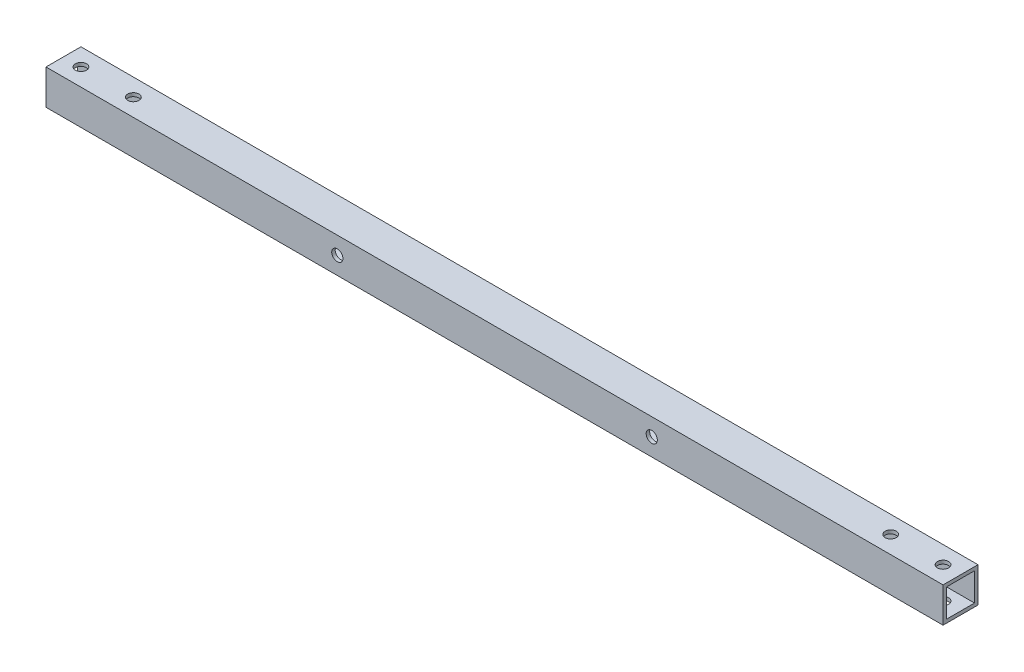
from build123d import *

# Parameters (mm, degrees)
SKETCH_1_W          = 10
SKETCH_1_H          = 10
EXTRUDE_1_DEPTH     = 128.363049395
SKETCH_2_W          = 8
SKETCH_2_H          = 8
CUT_EXTRUDE_1_DEPTH = 257.823460377
SKETCH_3_R          = 1.6
CUT_EXTRUDE_2_DEPTH = 129.849029682
SKETCH_4_R          = 1.6
CUT_EXTRUDE_3_DEPTH = 129.849029682


with BuildPart() as part:
    # ｽｹｯﾁ1 → ﾎﾞｽ - 押し出し1 (new, symmetric)
    with BuildSketch(Plane(origin=(0, 0, 0), x_dir=(0, 0, -1), z_dir=(1, 0, 0))):
        Rectangle(SKETCH_1_W, SKETCH_1_H)
    extrude(amount=EXTRUDE_1_DEPTH, both=True)

    # ｽｹｯﾁ2 → ｶｯﾄ - 押し出し1 (cut, through all)
    with BuildSketch(Plane(origin=(128.363049395, 0, 0), x_dir=(0, 0, -1), z_dir=(1, 0, 0))):
        Rectangle(SKETCH_2_W, SKETCH_2_H)
    extrude(amount=-CUT_EXTRUDE_1_DEPTH, mode=Mode.SUBTRACT)

    # ｽｹｯﾁ3 → ｶｯﾄ - 押し出し2 (cut, through all)
    with BuildSketch(Plane(origin=(0, 5, 0), x_dir=(1, 0, 0), z_dir=(0, 1, 0))):
        with Locations(Location((-123.363049395, 0, 0), (0, 0, 270))):
            Circle(SKETCH_3_R)
        with Locations(Location((-108.363049395, 0, 0), (0, 0, 270))):
            Circle(SKETCH_3_R)
        with Locations(Location((108.363049395, 0, 0), (0, 0, 270))):
            Circle(SKETCH_3_R)
        with Locations(Location((123.363049395, 0, 0), (0, 0, 270))):
            Circle(SKETCH_3_R)
    extrude(amount=-CUT_EXTRUDE_2_DEPTH, mode=Mode.SUBTRACT)

    # ｽｹｯﾁ4 → ｶｯﾄ - 押し出し3 (cut, through all)
    with BuildSketch(Plane.XY.offset(5)):
        with Locations((-45, 0)):
            Circle(SKETCH_4_R)
        with Locations((45, 0)):
            Circle(SKETCH_4_R)
    extrude(amount=-CUT_EXTRUDE_3_DEPTH, mode=Mode.SUBTRACT)


solid = part.part
